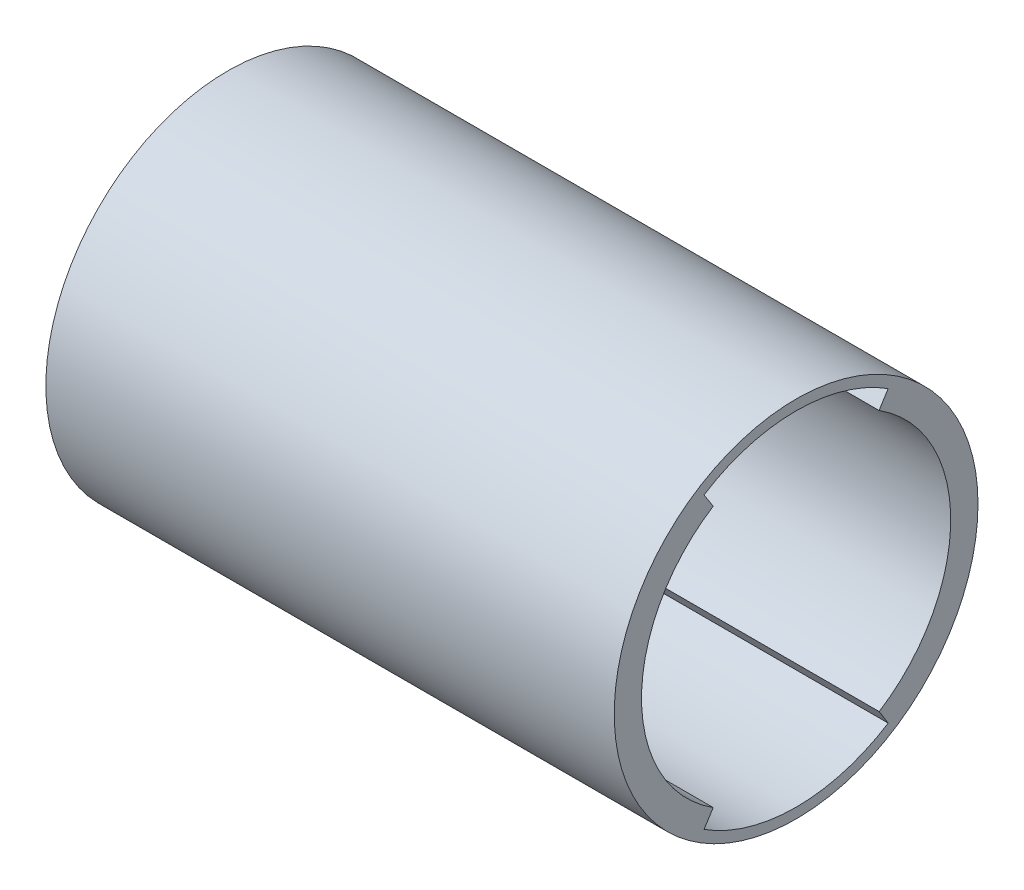
from build123d import *

# Parameters (mm, degrees)
SKETCH1_R           = 16
SKETCH1_R_2         = 13.6
BOSS_EXTRUDE1_DEPTH = 50
CUT_EXTRUDE1_DEPTH  = 55.881690936
CUT_EXTRUDE2_DEPTH  = 3.5


with BuildPart() as part:
    # Sketch1 → Boss-Extrude1 (new body)
    with BuildSketch(Plane(origin=(0, 0, 0), x_dir=(0, 0, -1), z_dir=(1, 0, 0))):
        Circle(SKETCH1_R)
        Circle(SKETCH1_R_2, mode=Mode.SUBTRACT)
    extrude(amount=BOSS_EXTRUDE1_DEPTH)

    # Sketch2 → Cut-Extrude1 (cut, through all)
    with BuildSketch(Plane(origin=(50, 0, 0), x_dir=(0, 0, -1), z_dir=(1, 0, 0))):
        with BuildLine():
            Line((-8.1, 12.743625858), (-7.295364238, 11.477702759))
            ThreePointArc((-7.295364238, 11.477702759), (0, 13.6), (7.295364238, 11.477702759))
            Line((7.295364238, 11.477702759), (8.1, 12.743625858))
            ThreePointArc((8.1, 12.743625858), (0, 15.1), (-8.1, 12.743625858))
        make_face()
        with BuildLine():
            Line((-8.1, -12.743625858), (-7.295364238, -11.477702759))
            ThreePointArc((-7.295364238, -11.477702759), (0.008056302, -13.599997614), (7.308957327, -11.469051521))
            Line((7.308957327, -11.469051521), (8.1, -12.743625858))
            ThreePointArc((8.1, -12.743625858), (0, -15.1), (-8.1, -12.743625858))
        make_face()
    extrude(amount=-CUT_EXTRUDE1_DEPTH, mode=Mode.SUBTRACT)

    # Sketch3 → Cut-Extrude2 (cut)
    with BuildSketch(Plane(origin=(0, 0, 0), x_dir=(-1, 0, 0), z_dir=(0, -0.5364238410596023, -0.8439487322953112))):
        with BuildLine():
            Line((-7, -13.6), (-7, -12.445895529))
            Line((-7, -12.445895529), (-25, -12.445895529))
            Line((-25, -12.445895529), (-25, -13.6))
            add(Edge.make_bspline(
                [(-25, -13.6), (-25.419648133, -14.53323317), (-22.215303237, -14.299464122), (-19.182889181, -14.398286796), (-18.428629005, -14.414668585), (-16.283931227, -14.396819072), (-13.186228061, -14.668811806), (-11.028088937, -13.12651294), (-8.819150609, -14.976468108), (-7, -13.6)],
                knots=[0, 0, 0, 0, 0.204097014, 0.238608821, 0.396578619, 0.439763334, 0.627271258, 0.685638773, 1, 1, 1, 1], degree=3))
        make_face()
    extrude(amount=-CUT_EXTRUDE2_DEPTH, mode=Mode.SUBTRACT)


solid = part.part
